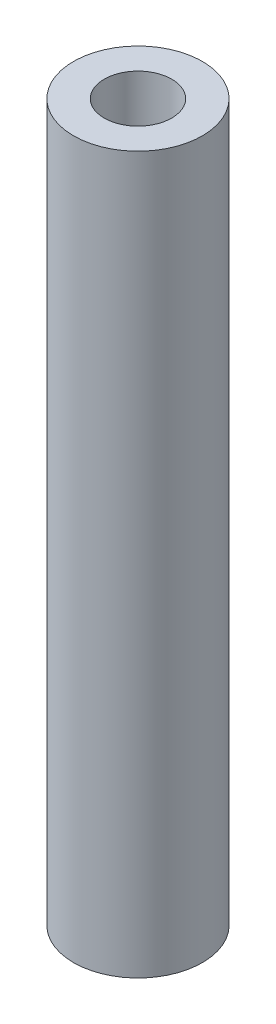
from build123d import *

# Parameters (mm, degrees)
SKETCH1_R           = 3.15
SKETCH1_R_2         = 1.65
BOSS_EXTRUDE1_DEPTH = 35


with BuildPart() as part:
    # Sketch1 → Boss-Extrude1 (new body)
    with BuildSketch(Plane(origin=(0, 0, 0), x_dir=(1, 0, 0), z_dir=(0, 1, 0))):
        with Locations(Location((0, 0, 0), (0, 0, 270))):
            Circle(SKETCH1_R)
        with Locations(Location((0, 0, 0), (0, 0, 270))):
            Circle(SKETCH1_R_2, mode=Mode.SUBTRACT)
    extrude(amount=BOSS_EXTRUDE1_DEPTH)


solid = part.part
